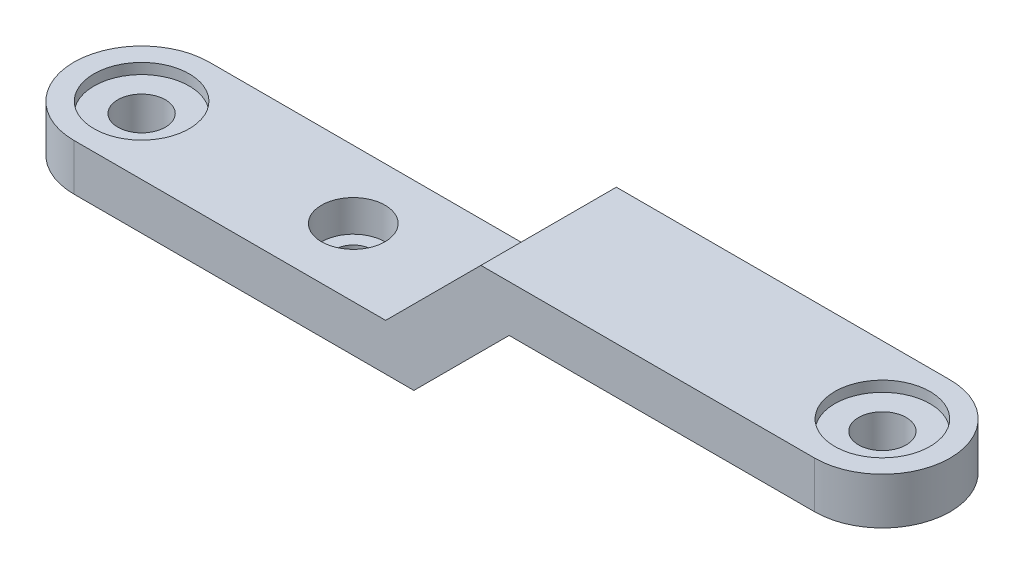
from build123d import *

# Parameters (mm, degrees)
EXTRUDE_1_DEPTH          = 6.4
SKETCH_2_OUTSIDE_W       = 101.77
SKETCH_2_OUTSIDE_H       = 31.77
CUT_EXTRUDE_1_DEPTH      = 85.121103179
CUT_EXTRUDE_2_DEPTH      = 84.533226922
CUT_EXTRUDE_2_DEPTH_BACK = 84.533226922
SKETCH_3_R               = 2.25
SKETCH_4_R               = 4.5
CUT_EXTRUDE_3_DEPTH      = 1
SKETCH_5_R               = 4.5
CUT_EXTRUDE_4_DEPTH      = 1
SKETCH_6_R               = 3
CUT_EXTRUDE_5_DEPTH      = 3
SKETCH_7_R               = 1.75
CUT_EXTRUDE_6_DEPTH      = 84.533226922


with BuildPart() as part:
    # 草图1 → 凸台-拉伸1 (new, symmetric)
    with BuildSketch(Plane.XY):
        Polygon((0, 0), (38.531067812, 0), (47.531067812, 9), (82.8, 9), (82.8, 13.4), (44.86, 13.4), (35.86, 4.4), (0, 4.4), align=None)
    extrude(amount=EXTRUDE_1_DEPTH, both=True)

    # 草图2 outside → 切除-拉伸1 (cut, through all)
    with BuildSketch(Plane(origin=(0, 13.4, 0), x_dir=(1, 0, 0), z_dir=(0, 1, 0))):
        with Locations((41.4, 0)):
            Rectangle(SKETCH_2_OUTSIDE_W, SKETCH_2_OUTSIDE_H)
        with BuildLine():
            Line((76.4, 6.4), (44.86, 6.4))
            Line((44.86, 6.4), (35.86, 6.4))
            Line((35.86, 6.4), (6.4, 6.4))
            ThreePointArc((6.4, 6.4), (0, 0), (6.4, -6.4))
            Line((6.4, -6.4), (35.86, -6.4))
            Line((35.86, -6.4), (44.86, -6.4))
            Line((44.86, -6.4), (76.4, -6.4))
            ThreePointArc((76.4, -6.4), (82.8, 0), (76.4, 6.4))
        make_face(mode=Mode.SUBTRACT)
    extrude(amount=-CUT_EXTRUDE_1_DEPTH, mode=Mode.SUBTRACT)

    # 草图3 → 切除-拉伸2 (cut, two sides: drawn at the far end of the back side and taken through both)
    with BuildSketch(Plane(origin=(0, 4.4, 0), x_dir=(1, 0, 0), z_dir=(0, 1, 0)).offset(-CUT_EXTRUDE_2_DEPTH_BACK)):
        with Locations(Location((6.4, 0, 0), (0, 0, 180))):
            Circle(SKETCH_3_R)
        with Locations(Location((76.4, 0, 0), (0, 0, 180))):
            Circle(SKETCH_3_R)
    extrude(amount=CUT_EXTRUDE_2_DEPTH + CUT_EXTRUDE_2_DEPTH_BACK, mode=Mode.SUBTRACT)

    # 草图4 → 切除-拉伸3 (cut)
    with BuildSketch(Plane(origin=(0, 13.4, 0), x_dir=(1, 0, 0), z_dir=(0, 1, 0))):
        with Locations(Location((76.4, 0, 0), (0, 0, 180))):
            Circle(SKETCH_4_R)
    extrude(amount=-CUT_EXTRUDE_3_DEPTH, mode=Mode.SUBTRACT)

    # 草图5 → 切除-拉伸4 (cut)
    with BuildSketch(Plane(origin=(0, 4.4, 0), x_dir=(1, 0, 0), z_dir=(0, 1, 0))):
        with Locations(Location((6.4, 0, 0), (0, 0, 180))):
            Circle(SKETCH_5_R)
    extrude(amount=-CUT_EXTRUDE_4_DEPTH, mode=Mode.SUBTRACT)

    # 草图6 → 切除-拉伸5 (cut)
    with BuildSketch(Plane(origin=(0, 4.4, 0), x_dir=(1, 0, 0), z_dir=(0, 1, 0))):
        with Locations(Location((26.4, 0, 0), (0, 0, 180))):
            Circle(SKETCH_6_R)
    extrude(amount=-CUT_EXTRUDE_5_DEPTH, mode=Mode.SUBTRACT)

    # 草图7 → 切除-拉伸6 (cut, through all)
    with BuildSketch(Plane(origin=(0, 4.4, 0), x_dir=(1, 0, 0), z_dir=(0, 1, 0))):
        with Locations(Location((26.4, 0, 0), (0, 0, 180))):
            Circle(SKETCH_7_R)
    extrude(amount=-CUT_EXTRUDE_6_DEPTH, mode=Mode.SUBTRACT)


solid = part.part
